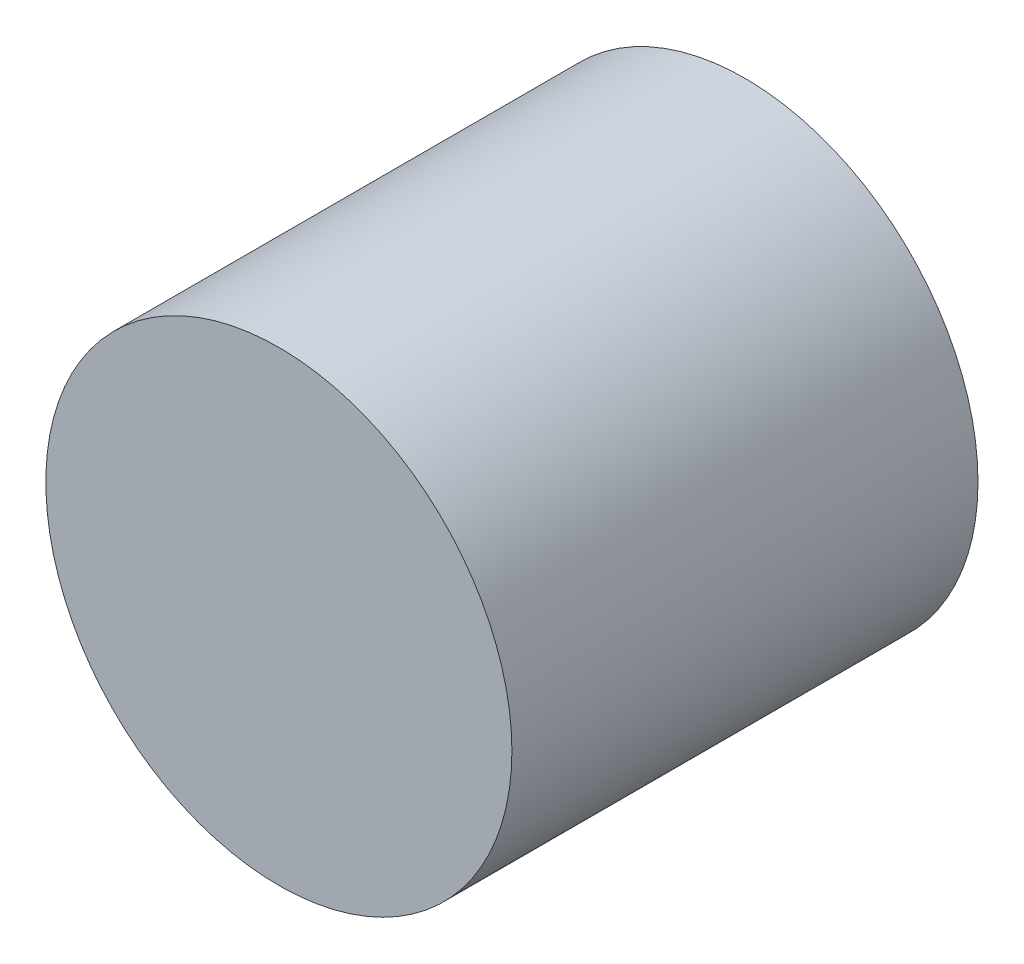
from build123d import *

# Parameters (mm, degrees)
SKETCH_6_R      = 3
EXTRUDE_6_DEPTH = 6


with BuildPart() as part:
    # Проход_ровно6 → Цилиндр_6 (new body)
    with BuildSketch(Plane.XY):
        Circle(SKETCH_6_R)
    extrude(amount=EXTRUDE_6_DEPTH)


solid = part.part
